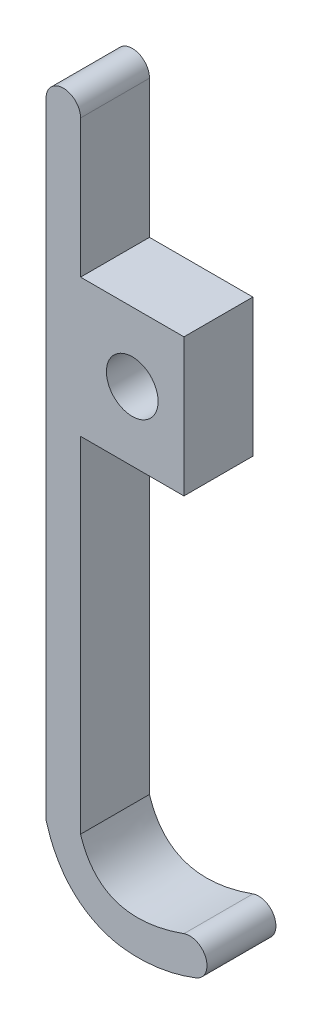
from build123d import *

# Parameters (mm, degrees)
SALIENTE_EXTRUIR1_DEPTH = 2
CROQUIS3_W              = 3
CROQUIS3_H              = 4
CROQUIS3_R              = 0.75
SALIENTE_EXTRUIR2_DEPTH = 2


with BuildPart() as part:
    # Croquis1 → Saliente-Extruir1 (new body)
    with BuildSketch(Plane.XY):
        with BuildLine():
            Line((0, 0), (0, -18))
            add(Edge.make_bspline(
                [(0, -18), (0.591537416, -19.861671452), (3, -19)],
                knots=[0, 0, 0, 1, 1, 1], degree=2))
            ThreePointArc((3, -19), (3.639206917, -19.302348338), (3.336858579, -19.941555255))
            add(Edge.make_bspline(
                [(-1, -18.155053134), (-0.975859651, -18.232741401), (-0.899448228, -18.466363972), (-0.756134802, -18.817826734), (-0.454907757, -19.317869663), (0.02797097, -19.792887209), (0.777302206, -20.197268894), (2.276173322, -20.352435091), (3.336858579, -19.941555255)],
                knots=[-0.039688193, -0.039688193, -0.039688193, 0.009047191, 0.057782575, 0.155253343, 0.285214367, 0.415175391, 0.610116928, 1, 1, 1], degree=2))
            Line((-1, -18.155053134), (-1, 0))
            ThreePointArc((-1, 0), (-0.5, 0.5), (0, 0))
        make_face()
    extrude(amount=SALIENTE_EXTRUIR1_DEPTH)

    # Croquis3 → Saliente-Extruir2 (add)
    with BuildSketch(Plane(origin=(0, 0, 0), x_dir=(-1, 0, 0), z_dir=(0, 0, -1))):
        with Locations((-1.5, -6)):
            Rectangle(CROQUIS3_W, CROQUIS3_H)
        with Locations((-1.5, -6)):
            Circle(CROQUIS3_R, mode=Mode.SUBTRACT)
    extrude(amount=-SALIENTE_EXTRUIR2_DEPTH)


solid = part.part
